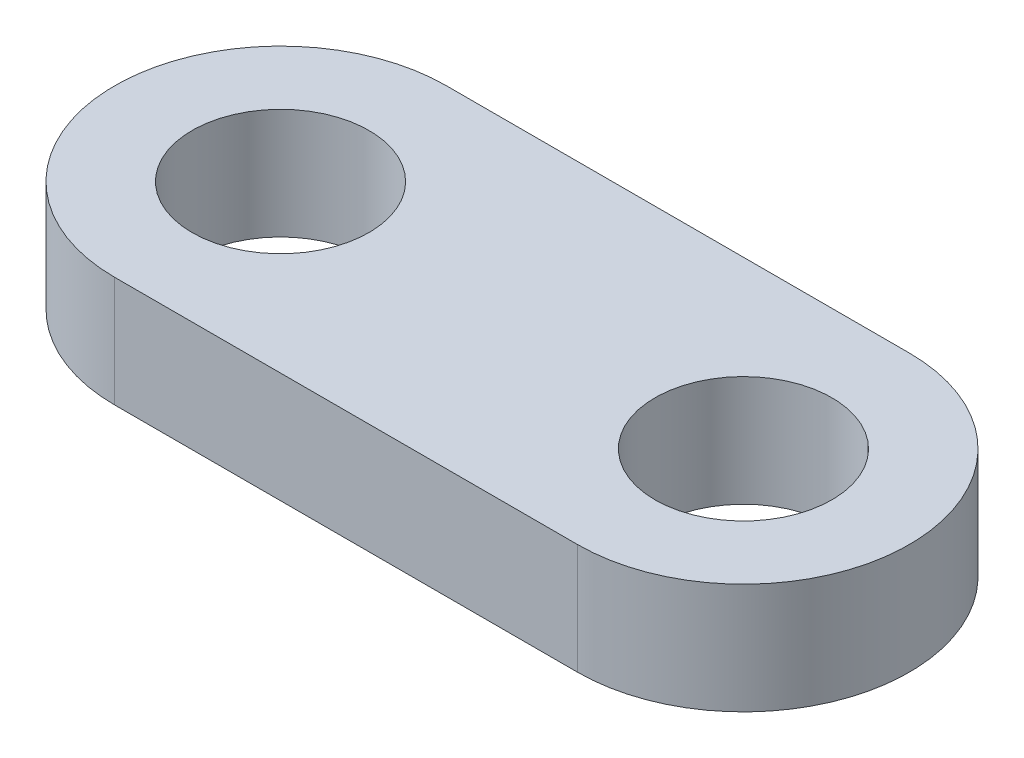
from build123d import *

# Parameters (mm, degrees)
SKETCH1_R           = 4
BOSS_EXTRUDE1_DEPTH = 5
SCALE1_SCALE        = 0.7


with BuildPart() as part:
    # Sketch1 → Boss-Extrude1 (new body)
    with BuildSketch(Plane(origin=(0, 0, 0), x_dir=(1, 0, 0), z_dir=(0, 1, 0))):
        with BuildLine():
            Line((0, 7.5), (20.93, 7.5))
            ThreePointArc((20.93, 7.5), (28.43, 0), (20.93, -7.5))
            Line((20.93, -7.5), (0, -7.5))
            ThreePointArc((0, -7.5), (-7.5, 0), (0, 7.5))
        make_face()
        with Locations(Location((20.93, 0, 0), (0, 0, 270))):
            Circle(SKETCH1_R, mode=Mode.SUBTRACT)
        with Locations(Location((0, 0, 0), (0, 0, 270))):
            Circle(SKETCH1_R, mode=Mode.SUBTRACT)
    extrude(amount=BOSS_EXTRUDE1_DEPTH)


with BuildPart() as part_1:
    # Scale1: scaled about (10.465, 2.5, 0)
    add(part.part.scale(SCALE1_SCALE).moved(Location((3.1395, 0.75, 0))))


solid = part_1.part
